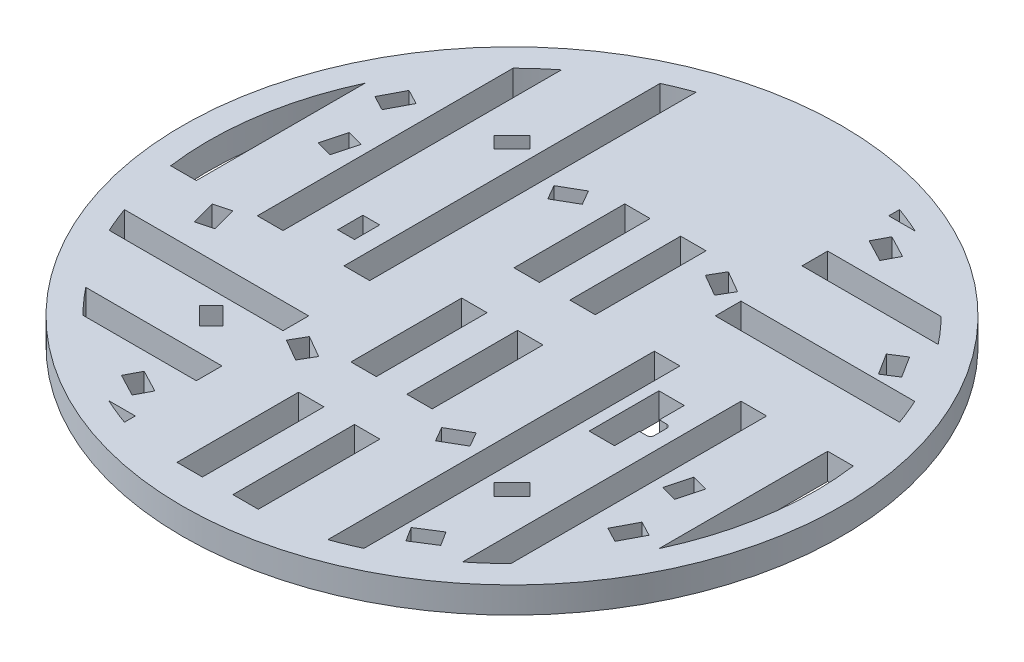
from build123d import *

# Parameters (mm, degrees)
SKETCH_1_W          = 2.91
SKETCH_1_H          = 12.7
EXTRUDE_1_DEPTH     = 3
EXTRUDE_2_DEPTH     = 3
CUT_EXTRUDE_3_DEPTH = 3
SKETCH_3_W          = 1.93
SKETCH_3_H          = 2.895
CUT_EXTRUDE_1_DEPTH = 3


with BuildPart() as part:
    # 스케치1 → 보스-돌출1 (new body)
    with BuildSketch(Plane(origin=(0, 0, 0), x_dir=(1, 0, 0), z_dir=(0, 1, 0))):
        Polygon((-17, -33.75), (-17, 33.75), (-4.66, 33.75), (-1.75, 33.75), (1.75, 33.75), (4.66, 33.75), (17, 33.75), (17, -33.75), (4.66, -33.75), (4.66, -19.81), (1.75, -19.81), (1.75, -33.75), (-1.75, -33.75), (-1.75, -19.81), (-4.66, -19.81), (-4.66, -33.75), align=None)
        with Locations((-3.205, 11.24)):
            Rectangle(SKETCH_1_W, SKETCH_1_H, mode=Mode.SUBTRACT)
        with Locations((-3.205, -7.46)):
            Rectangle(SKETCH_1_W, SKETCH_1_H, mode=Mode.SUBTRACT)
        with Locations((3.205, 11.24)):
            Rectangle(SKETCH_1_W, SKETCH_1_H, mode=Mode.SUBTRACT)
        with Locations((3.205, -7.46)):
            Rectangle(SKETCH_1_W, SKETCH_1_H, mode=Mode.SUBTRACT)
    extrude(amount=EXTRUDE_1_DEPTH)

    # 스케치2 → 보스-돌출2 (add)
    with BuildSketch(Plane(origin=(0, 3, 0), x_dir=(1, 0, 0), z_dir=(0, 1, 0))):
        with BuildLine():
            Line((-17, -33.75), (-17, 33.75))
            ThreePointArc((-17, 33.75), (-37.789714209, 0), (-17, -33.75))
        make_face()
        with BuildLine():
            ThreePointArc((-17, -33.75), (0, -37.789714209), (17, -33.75))
            Line((17, -33.75), (4.66, -33.75))
            Line((4.66, -33.75), (1.75, -33.75))
            Line((1.75, -33.75), (-1.75, -33.75))
            Line((-1.75, -33.75), (-4.66, -33.75))
            Line((-4.66, -33.75), (-17, -33.75))
        make_face()
        with BuildLine():
            ThreePointArc((37.789714209, 0), (32.175205062, 19.819653862), (17, 33.75))
            Line((17, 33.75), (17, -33.75))
            ThreePointArc((17, -33.75), (32.175205062, -19.819653862), (37.789714209, 0))
        make_face()
        with BuildLine():
            Line((-17, 33.75), (17, 33.75))
            ThreePointArc((17, 33.75), (0, 37.789714209), (-17, 33.75))
        make_face()
    extrude(amount=-EXTRUDE_2_DEPTH)

    # 스케치5 → 컷-돌출3 (cut)
    with BuildSketch(Plane(origin=(0, 3, 0), x_dir=(1, 0, 0), z_dir=(0, 1, 0))):
        with BuildLine():
            Line((-34.476203601, -4.66), (-31.537469067, -4.66))
            Line((-31.537469067, -4.66), (-31.537469067, 14.687146066))
            ThreePointArc((-31.537469067, 14.687146066), (-34.395192397, 5.224457362), (-34.476203601, -4.66))
        make_face()
        with BuildLine():
            Line((-24.537469067, 24.662457836), (-24.537469067, -4.66))
            Line((-24.537469067, -4.66), (-21.598734534, -4.66))
            Line((-21.598734534, -4.66), (-21.598734534, 27.273043125))
            ThreePointArc((-21.598734534, 27.273043125), (-23.10500183, 26.009288825), (-24.537469067, 24.662457836))
        make_face()
        with BuildLine():
            Line((-14.598734534, 31.578492123), (-14.598734534, -4.66))
            Line((-14.598734534, -4.66), (-11.66, -4.66))
            Line((-11.66, -4.66), (-11.66, 32.777562672))
            ThreePointArc((-11.66, 32.777562672), (-13.143048633, 32.211558288), (-14.598734534, 31.578492123))
        make_face()
        with BuildLine():
            Line((31.578492123, 14.598734534), (11.66, 14.598734534))
            Line((11.66, 14.598734534), (11.66, 11.66))
            Line((11.66, 11.66), (32.777562672, 11.66))
            ThreePointArc((32.777562672, 11.66), (32.211558288, 13.143048633), (31.578492123, 14.598734534))
        make_face()
        with BuildLine():
            Line((24.662457836, 24.537469067), (11.66, 24.537469067))
            Line((11.66, 24.537469067), (11.66, 21.598734534))
            Line((11.66, 21.598734534), (27.273043125, 21.598734534))
            ThreePointArc((27.273043125, 21.598734534), (26.009288825, 23.10500183), (24.662457836, 24.537469067))
        make_face()
        with BuildLine():
            Line((11.66, 31.537469067), (14.687146066, 31.537469067))
            ThreePointArc((14.687146066, 31.537469067), (13.188156979, 32.193116194), (11.66, 32.777562672))
            Line((11.66, 32.777562672), (11.66, 31.537469067))
        make_face()
        with BuildLine():
            Line((14.598734534, -31.578492123), (14.598734534, 4.66))
            Line((14.598734534, 4.66), (11.66, 4.66))
            Line((11.66, 4.66), (11.66, -32.777562672))
            ThreePointArc((11.66, -32.777562672), (13.143048633, -32.211558288), (14.598734534, -31.578492123))
        make_face()
        with BuildLine():
            Line((24.537469067, -24.662457836), (24.537469067, 4.66))
            Line((24.537469067, 4.66), (21.598734534, 4.66))
            Line((21.598734534, 4.66), (21.598734534, -27.273043125))
            ThreePointArc((21.598734534, -27.273043125), (23.10500183, -26.009288825), (24.537469067, -24.662457836))
        make_face()
        with BuildLine():
            Line((31.537469067, 4.66), (31.537469067, -14.687146066))
            ThreePointArc((31.537469067, -14.687146066), (34.395192397, -5.224457362), (34.476203601, 4.66))
            Line((34.476203601, 4.66), (31.537469067, 4.66))
        make_face()
        with BuildLine():
            Line((-31.578492123, -14.598734534), (-11.66, -14.598734534))
            Line((-11.66, -14.598734534), (-11.66, -11.66))
            Line((-11.66, -11.66), (-32.777562672, -11.66))
            ThreePointArc((-32.777562672, -11.66), (-32.211558288, -13.143048633), (-31.578492123, -14.598734534))
        make_face()
        with BuildLine():
            Line((-24.662457836, -24.537469067), (-11.66, -24.537469067))
            Line((-11.66, -24.537469067), (-11.66, -21.598734534))
            Line((-11.66, -21.598734534), (-27.273043125, -21.598734534))
            ThreePointArc((-27.273043125, -21.598734534), (-26.009288825, -23.10500183), (-24.662457836, -24.537469067))
        make_face()
        with BuildLine():
            Line((-11.66, -31.537469067), (-14.687146066, -31.537469067))
            ThreePointArc((-14.687146066, -31.537469067), (-13.188156979, -32.193116194), (-11.66, -32.777562672))
            Line((-11.66, -32.777562672), (-11.66, -31.537469067))
        make_face()
    extrude(amount=-CUT_EXTRUDE_3_DEPTH, mode=Mode.SUBTRACT)

    # 스케치3 → 컷-돌출1 (cut)
    with BuildSketch(Plane(origin=(0, 3, 0), x_dir=(1, 0, 0), z_dir=(0, 1, 0))):
        Polygon((-13.921720976, -29.640380671), (-16.485116171, -28.295007088), (-15.588200449, -26.586076958), (-13.024805254, -27.931450541), align=None)
        Polygon((-29.640380671, 13.921720976), (-28.295007088, 16.485116171), (-26.586076958, 15.588200449), (-27.931450541, 13.024805254), align=None)
        Polygon((13.921720976, 29.640380671), (16.485116171, 28.295007088), (15.588200449, 26.586076958), (13.024805254, 27.931450541), align=None)
        Polygon((26.876754365, 18.708462151), (28.424032932, 16.261636853), (26.792816067, 15.230117809), (25.2455375, 17.676943106), align=None)
        Polygon((29.640380671, -13.921720976), (28.295007088, -16.485116171), (26.586076958, -15.588200449), (27.931450541, -13.024805254), align=None)
        Polygon((-28.294726577, -6.082986865), (-27.545445441, -8.879342132), (-25.681208596, -8.379821375), (-26.430489732, -5.583466108), align=None)
        Polygon((-27.545445441, 8.879342132), (-28.294726577, 6.082986865), (-26.430489732, 5.583466108), (-25.681208596, 8.379821375), align=None)
        Polygon((27.545445441, -8.879342132), (28.294726577, -6.082986865), (26.430489732, -5.583466108), (25.681208596, -8.379821375), align=None)
        Polygon((-18.947986862, -16.900912731), (-16.900912731, -18.947986862), (-15.536196643, -17.583270774), (-17.583270774, -15.536196643), align=None)
        Polygon((-16.900912731, 18.947986862), (-18.947986862, 16.900912731), (-17.583270774, 15.536196643), (-15.536196643, 17.583270774), align=None)
        with BuildLine():
            Line((15.862041837, -7.0175654), (18.772041837, -7.0175654))
            Line((18.772041837, -7.0175654), (18.772041837, -4.1605654))
            Line((18.772041837, -4.1605654), (19.614041677, -4.1605654))
            ThreePointArc((19.614041677, -4.1605654), (19.916683492, -4.035207055), (20.042041837, -3.73256524))
            Line((20.042041837, -3.73256524), (20.042041837, -2.30256556))
            ThreePointArc((20.042041837, -2.30256556), (19.916683492, -1.999923745), (19.614041677, -1.8745654))
            Line((19.614041677, -1.8745654), (18.772041837, -1.8745654))
            Line((18.772041837, -1.8745654), (18.772041837, 0.9824346))
            Line((18.772041837, 0.9824346), (15.862041837, 0.9824346))
            Line((15.862041837, 0.9824346), (15.862041837, -7.0175654))
        make_face()
        Polygon((18.708462151, -26.876754365), (16.261636853, -28.424032932), (15.230117809, -26.792816067), (17.676943106, -25.2455375), align=None)
        Polygon((16.900912731, -18.947986862), (18.947986862, -16.900912731), (17.583270774, -15.536196643), (15.536196643, -17.583270774), align=None)
        Polygon((-10.527707159, 15.339523687), (-8.020563615, 16.787023687), (-7.055563615, 15.115594658), (-9.562707159, 13.668094658), align=None)
        with Locations((-17.583270774, 0)):
            Rectangle(SKETCH_3_W, SKETCH_3_H)
        Polygon((8.020563615, 16.787023687), (10.527707159, 15.339523687), (9.562707159, 13.668094658), (7.055563615, 15.115594658), align=None)
        Polygon((10.527707159, -15.339523687), (8.020563615, -16.787023687), (7.055563615, -15.115594658), (9.562707159, -13.668094658), align=None)
        Polygon((-8.020563615, -16.787023687), (-10.527707159, -15.339523687), (-9.562707159, -13.668094658), (-7.055563615, -15.115594658), align=None)
    extrude(amount=-CUT_EXTRUDE_1_DEPTH, mode=Mode.SUBTRACT)


solid = part.part
